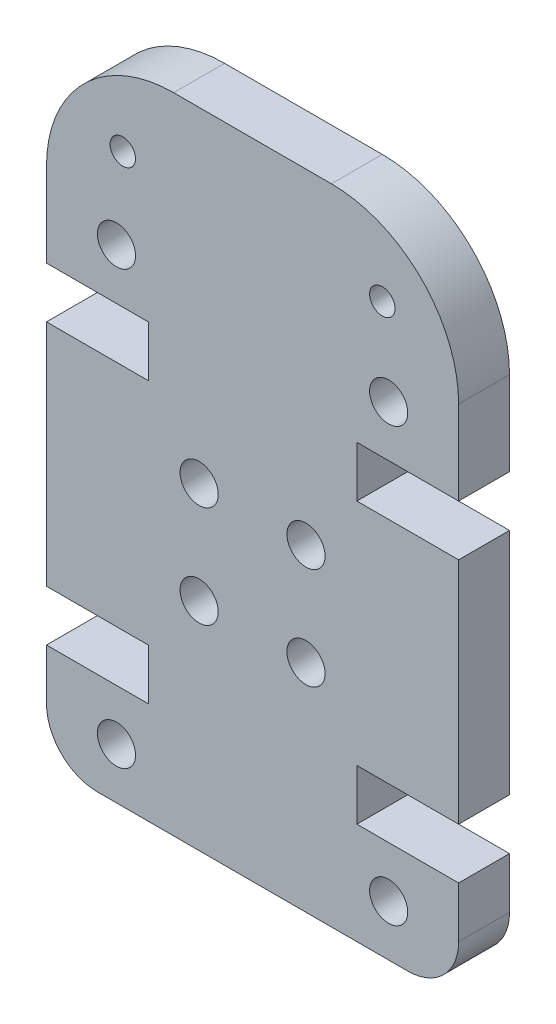
from build123d import *

# Parameters (mm, degrees)
SKETCH1_R           = 0.75
SKETCH1_R_2         = 0.5
BOSS_EXTRUDE1_DEPTH = 2


with BuildPart() as part:
    # Sketch1 → Boss-Extrude1 (new body)
    with BuildSketch(Plane.XY):
        with BuildLine():
            Line((0, 6), (0, 15))
            Line((0, 15), (4, 15))
            Line((4, 15), (4, 17))
            Line((4, 17), (0, 17))
            Line((0, 17), (0, 20.3))
            ThreePointArc((0, 20.3), (1.464466094, 23.835533906), (5, 25.3))
            Line((5, 25.3), (11.2, 25.3))
            ThreePointArc((11.2, 25.3), (14.735533906, 23.835533906), (16.2, 20.3))
            Line((16.2, 20.3), (16.2, 17))
            Line((16.2, 17), (12.2, 17))
            Line((12.2, 17), (12.2, 15))
            Line((12.2, 15), (16.2, 15))
            Line((16.2, 15), (16.2, 6))
            Line((16.2, 6), (12.2, 6))
            Line((12.2, 6), (12.2, 4))
            Line((12.2, 4), (16.2, 4))
            Line((16.2, 4), (16.2, 2))
            ThreePointArc((16.2, 2), (15.614213562, 0.585786438), (14.2, 0))
            Line((14.2, 0), (2, 0))
            ThreePointArc((2, 0), (0.585786438, 0.585786438), (0, 2))
            Line((0, 2), (0, 4))
            Line((0, 4), (4, 4))
            Line((4, 4), (4, 6))
            Line((4, 6), (0, 6))
        make_face()
        with Locations(Location((6, 12.5, 0), (0, 0, 180))):
            Circle(SKETCH1_R, mode=Mode.SUBTRACT)
        with Locations(Location((10.2, 12.5, 0), (0, 0, 180))):
            Circle(SKETCH1_R, mode=Mode.SUBTRACT)
        with Locations(Location((2.75, 19, 0), (0, 0, 180))):
            Circle(SKETCH1_R, mode=Mode.SUBTRACT)
        with Locations(Location((13.45, 19, 0), (0, 0, 180))):
            Circle(SKETCH1_R, mode=Mode.SUBTRACT)
        with Locations((10.2, 8.5)):
            Circle(SKETCH1_R, mode=Mode.SUBTRACT)
        with Locations((6, 8.5)):
            Circle(SKETCH1_R, mode=Mode.SUBTRACT)
        with Locations((3, 22.3)):
            Circle(SKETCH1_R_2, mode=Mode.SUBTRACT)
        with Locations((13.2, 22.3)):
            Circle(SKETCH1_R_2, mode=Mode.SUBTRACT)
        with Locations((13.45, 2)):
            Circle(SKETCH1_R, mode=Mode.SUBTRACT)
        with Locations((2.75, 2)):
            Circle(SKETCH1_R, mode=Mode.SUBTRACT)
    extrude(amount=BOSS_EXTRUDE1_DEPTH)


solid = part.part
